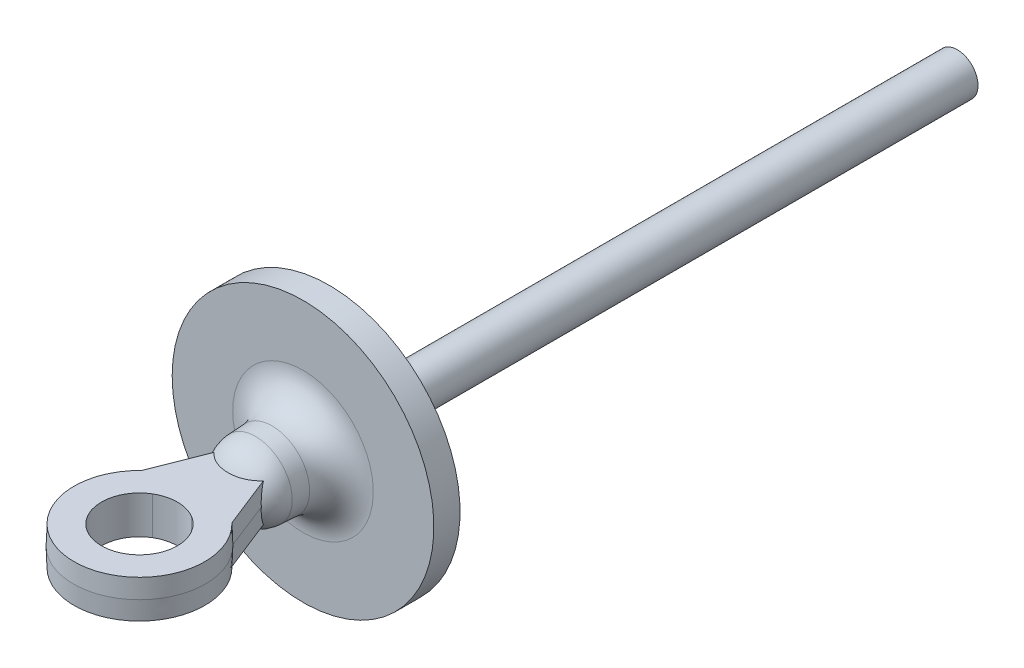
from build123d import *

# Parameters (mm, degrees)
SKETCH1_R                     = 3
BASE_EXTRUDE_DEPTH            = 6
BASE_EXTRUDE_TAPER            = 3
FILLET1_R                     = 2.5
BOSS_EXTRUDE1_DEPTH           = 1.45
BOSS_EXTRUDE1_TAPER           = 2
BOSS_EXTRUDE1_OTHER_WAY_DEPTH = 1.45
BOSS_EXTRUDE1_OTHER_WAY_TAPER = 2
SKETCH3_R                     = 2.9
CUT_EXTRUDE1_DEPTH            = 19.796475854
SKETCH4_R                     = 1.585
BOSS_EXTRUDE2_DEPTH           = 50
SKETCH5_R                     = 10
SKETCH5_R_2                   = 1.585
BOSS_EXTRUDE3_DEPTH           = 1
SKETCH11_R                    = 10
SKETCH11_R_2                  = 9
EXTRUDE1_DEPTH                = 1
FILLET5_R                     = 2.5
FILLET6_R                     = 2


with BuildPart() as part:
    # Sketch1 → Base-Extrude (new body)
    with BuildSketch(Plane.XY):
        Circle(SKETCH1_R)
    extrude(amount=BASE_EXTRUDE_DEPTH, taper=BASE_EXTRUDE_TAPER)

    # Fillet1
    fillet1_edges = [part.edges().sort_by_distance(p)[0] for p in [
        (-2.685553324, 0, 6),
    ]]
    fillet(fillet1_edges, radius=FILLET1_R)

    # Sketch2 → Boss-Extrude1 (add)
    with BuildSketch(Plane(origin=(0, 0, 0), x_dir=(1, 0, 0), z_dir=(0, 1, 0))):
        with BuildLine():
            Line((3.495897193, -8.85566154), (0, 0))
            Line((0, 0), (-3.495897193, -8.85566154))
            ThreePointArc((-3.495897193, -8.85566154), (0, -17.55), (3.495897193, -8.85566154))
        make_face()
    extrude(amount=BOSS_EXTRUDE1_DEPTH, taper=BOSS_EXTRUDE1_TAPER)

    # Sketch2 → Boss-Extrude1 other way (add)
    with BuildSketch(Plane(origin=(0, 0, 0), x_dir=(1, 0, 0), z_dir=(0, 1, 0))):
        with BuildLine():
            Line((3.495897193, -8.85566154), (0, 0))
            Line((0, 0), (-3.495897193, -8.85566154))
            ThreePointArc((-3.495897193, -8.85566154), (0, -17.55), (3.495897193, -8.85566154))
        make_face()
    extrude(amount=-BOSS_EXTRUDE1_OTHER_WAY_DEPTH, taper=BOSS_EXTRUDE1_OTHER_WAY_TAPER)

    # Sketch3 → Cut-Extrude1 (cut, through all)
    with BuildSketch(Plane.XZ.offset(1.45)):
        with Locations(Location((0, 12.5, 0), (0, 0, 270))):
            Circle(SKETCH3_R)
    extrude(amount=-CUT_EXTRUDE1_DEPTH, mode=Mode.SUBTRACT)

    # Sketch4 → Boss-Extrude2 (add)
    with BuildSketch(Plane(origin=(0, 0, 0), x_dir=(-1, 0, 0), z_dir=(0, 0, -1))):
        with Locations(Location((0, 0, 0), (0, 0, 180))):
            Circle(SKETCH4_R)
    extrude(amount=BOSS_EXTRUDE2_DEPTH)

    # Sketch5 → Boss-Extrude3 (add)
    with BuildSketch(Plane(origin=(0, 0, 0), x_dir=(-1, 0, 0), z_dir=(0, 0, -1))):
        Circle(SKETCH5_R)
        Circle(SKETCH5_R_2, mode=Mode.SUBTRACT)
    extrude(amount=BOSS_EXTRUDE3_DEPTH)

    # Sketch11 → Extrude1 (add)
    with BuildSketch(Plane(origin=(0, 0, -1), x_dir=(-1, 0, 0), z_dir=(0, 0, -1))):
        Circle(SKETCH11_R)
        Circle(SKETCH11_R_2, mode=Mode.SUBTRACT)
    extrude(amount=EXTRUDE1_DEPTH)

    # Fillet5
    fillet5_edges = [part.edges().sort_by_distance(p)[0] for p in [
        (-3, 0, 0),
    ]]
    fillet(fillet5_edges, radius=FILLET5_R)

    # Fillet6
    fillet6_edges = [part.edges().sort_by_distance(p)[0] for p in [
        (-1.585, 0, -1),
    ]]
    fillet(fillet6_edges, radius=FILLET6_R)


solid = part.part
